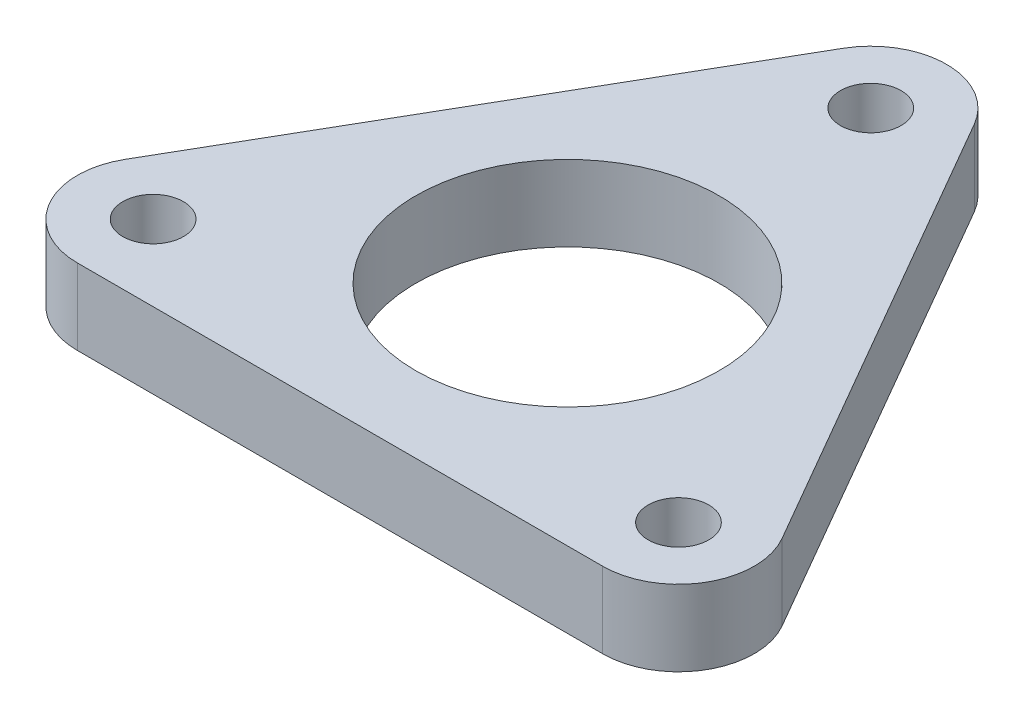
from build123d import *

# Parameters (mm, degrees)
RESSALTO_EXTRUS_O1_DEPTH = 10


with BuildPart() as part:
    # Esboço1 → Ressalto-extrusão1 (new body)
    with BuildSketch(Plane(origin=(0, 0, 0), x_dir=(1, 0, 0), z_dir=(0, 1, 0))):
        with BuildLine():
            ThreePointArc((-39.209518669, -7.912878475), (-38.076880663, -12.253618198), (-36.465309506, -16.440231222))
            ThreePointArc((-36.465309506, -16.440231222), (-33.509440947, -16.163395048), (-31.176914536, -18))
            Line((-31.176914536, -18), (-17.320508076, -10))
            ThreePointArc((-17.320508076, -10), (-17.320508076, 10), (0, 20))
            Line((0, 20), (0, 36))
            ThreePointArc((0, 36), (-2.75680975, 37.101724651), (-3.994996871, 39.8))
            ThreePointArc((-3.994996871, 39.8), (-8.426495684, 39.102355051), (-12.752005558, 37.912878475))
            Line((-12.752005558, 37.912878475), (-39.209518669, -7.912878475))
        make_face()
        with BuildLine():
            Line((-8.660254038, 45), (-12.752005558, 37.912878475))
            ThreePointArc((-12.752005558, 37.912878475), (-8.426495684, 39.102355051), (-3.994996871, 39.8))
            ThreePointArc((-3.994996871, 39.8), (-2.898275349, 42.75680975), (0, 44))
            Line((0, 44), (0, 50))
            ThreePointArc((0, 50), (-5, 48.660254038), (-8.660254038, 45))
        make_face()
        with BuildLine():
            ThreePointArc((8.660254038, 45), (5, 48.660254038), (0, 50))
            Line((0, 50), (0, 44))
            ThreePointArc((0, 44), (2.828427125, 42.828427125), (4, 40))
            ThreePointArc((4, 40), (3.998749022, 39.899968716), (3.994996871, 39.8))
            ThreePointArc((3.994996871, 39.8), (8.426495684, 39.102355051), (12.752005558, 37.912878475))
            Line((12.752005558, 37.912878475), (8.660254038, 45))
        make_face()
        with BuildLine():
            Line((0, 36), (0, 20))
            ThreePointArc((0, 20), (14.142135624, 14.142135624), (20, 0))
            ThreePointArc((20, 0), (19.318516526, -5.176380902), (17.320508076, -10))
            Line((17.320508076, -10), (31.176914536, -18))
            ThreePointArc((31.176914536, -18), (33.509440947, -16.163395048), (36.465309506, -16.440231222))
            ThreePointArc((36.465309506, -16.440231222), (38.076880663, -12.253618198), (39.209518669, -7.912878475))
            Line((39.209518669, -7.912878475), (12.752005558, 37.912878475))
            ThreePointArc((12.752005558, 37.912878475), (8.426495684, 39.102355051), (3.994996871, 39.8))
            ThreePointArc((3.994996871, 39.8), (2.75680975, 37.101724651), (0, 36))
        make_face()
        with BuildLine():
            ThreePointArc((-30.641016151, -20), (-31.127982273, -21.912744878), (-32.470312635, -23.359768778))
            ThreePointArc((-32.470312635, -23.359768778), (-29.65038498, -26.848736852), (-26.457513111, -30))
            Line((-26.457513111, -30), (26.457513111, -30))
            ThreePointArc((26.457513111, -30), (29.65038498, -26.848736852), (32.470312635, -23.359768778))
            ThreePointArc((32.470312635, -23.359768778), (30.752631197, -20.938329603), (31.176914536, -18))
            Line((31.176914536, -18), (17.320508076, -10))
            ThreePointArc((17.320508076, -10), (0, -20), (-17.320508076, -10))
            Line((-17.320508076, -10), (-31.176914536, -18))
            ThreePointArc((-31.176914536, -18), (-30.777312846, -18.96472382), (-30.641016151, -20))
        make_face()
        with BuildLine():
            ThreePointArc((-43.301270189, -15), (-44.641016151, -20), (-43.301270189, -25))
            Line((-43.301270189, -25), (-38.105117767, -22))
            ThreePointArc((-38.105117767, -22), (-38.477621103, -18.868424796), (-36.465309506, -16.440231222))
            ThreePointArc((-36.465309506, -16.440231222), (-38.076880663, -12.253618198), (-39.209518669, -7.912878475))
            Line((-39.209518669, -7.912878475), (-43.301270189, -15))
        make_face()
        with BuildLine():
            Line((-38.105117767, -22), (-43.301270189, -25))
            ThreePointArc((-43.301270189, -25), (-39.641016151, -28.660254038), (-34.641016151, -30))
            Line((-34.641016151, -30), (-26.457513111, -30))
            ThreePointArc((-26.457513111, -30), (-29.65038498, -26.848736852), (-32.470312635, -23.359768778))
            ThreePointArc((-32.470312635, -23.359768778), (-35.579345754, -23.888384955), (-38.105117767, -22))
        make_face()
        with BuildLine():
            Line((38.105117767, -22), (43.301270189, -25))
            ThreePointArc((43.301270189, -25), (44.641016151, -20), (43.301270189, -15))
            Line((43.301270189, -15), (39.209518669, -7.912878475))
            ThreePointArc((39.209518669, -7.912878475), (38.076880663, -12.253618198), (36.465309506, -16.440231222))
            ThreePointArc((36.465309506, -16.440231222), (38.054018746, -17.913995856), (38.641016151, -20))
            ThreePointArc((38.641016151, -20), (38.504719457, -21.03527618), (38.105117767, -22))
        make_face()
        with BuildLine():
            ThreePointArc((32.470312635, -23.359768778), (29.65038498, -26.848736852), (26.457513111, -30))
            Line((26.457513111, -30), (34.641016151, -30))
            ThreePointArc((34.641016151, -30), (39.641016151, -28.660254038), (43.301270189, -25))
            Line((43.301270189, -25), (38.105117767, -22))
            ThreePointArc((38.105117767, -22), (35.579345754, -23.888384955), (32.470312635, -23.359768778))
        make_face()
    extrude(amount=RESSALTO_EXTRUS_O1_DEPTH)


solid = part.part
